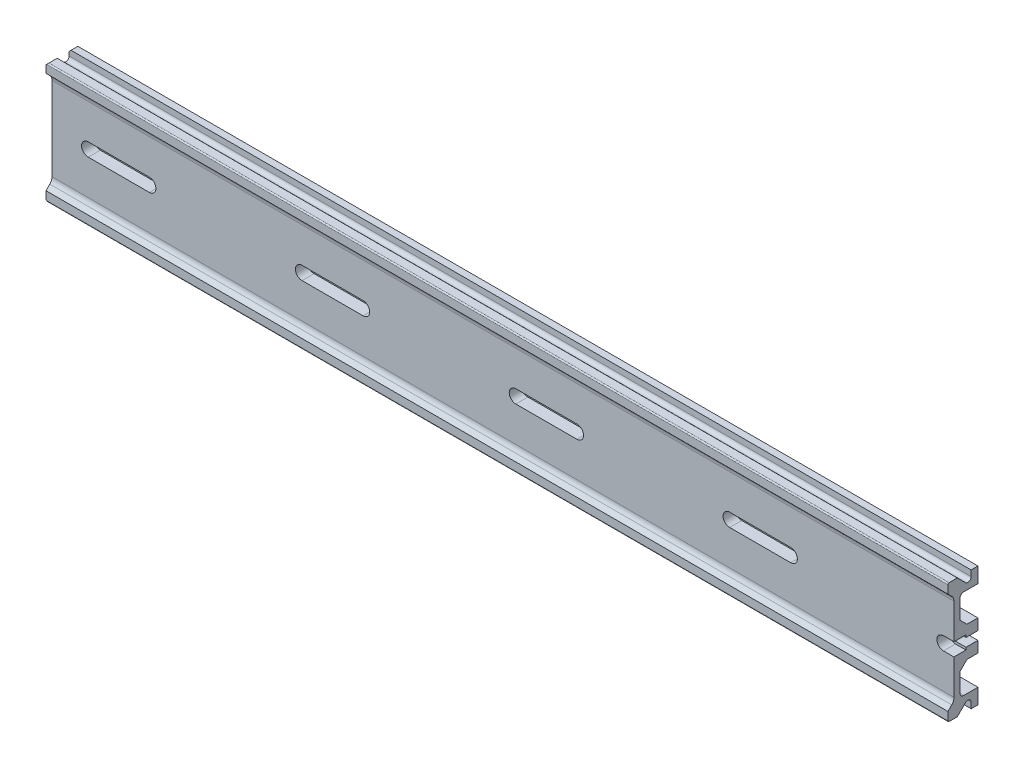
from build123d import *

# Parameters (mm, degrees)
SKETCH1_W           = 1000
SKETCH1_H           = 100
BOSS_EXTRUDE1_DEPTH = 25
CUT_EXTRUDE1_DEPTH  = 1002.561281201
CUT_EXTRUDE2_DEPTH  = 1002.561281201
CUT_EXTRUDE3_DEPTH  = 1002.561281201
CUT_EXTRUDE4_DEPTH  = 1002.561281201
CUT_EXTRUDE5_DEPTH  = 10
CUT_EXTRUDE6_DEPTH  = 504.110335811
CUT_EXTRUDE7_DEPTH  = 10
CUT_EXTRUDE8_DEPTH  = 504.110335811
CUT_EXTRUDE9_DEPTH  = 10
CUT_EXTRUDE10_DEPTH = 504.110335811
CUT_EXTRUDE11_DEPTH = 10
CUT_EXTRUDE12_DEPTH = 504.110335811
CUT_EXTRUDE13_DEPTH = 10
CUT_EXTRUDE14_DEPTH = 504.110335811
CUT_EXTRUDE15_DEPTH = 10
CUT_EXTRUDE16_DEPTH = 504.110335811
CHAMFER1_SIZE       = 5.8
CHAMFER2_SIZE       = 1.5
FILLET1_R           = 1
FILLET2_R           = 3.2
FILLET3_R           = 6.3
CUT_EXTRUDE17_START = -250
CUT_EXTRUDE17_DEPTH = 250


with BuildPart() as part:
    # Sketch1 → Boss-Extrude1 (new body)
    with BuildSketch(Plane(origin=(0, 0, 0), x_dir=(-1, 0, 0), z_dir=(0, 0, -1))):
        Rectangle(SKETCH1_W, SKETCH1_H)
    extrude(amount=-BOSS_EXTRUDE1_DEPTH)

    # Sketch2 → Cut-Extrude1 (cut, through all)
    with BuildSketch(Plane(origin=(500, 0, 0), x_dir=(0, 0, -1), z_dir=(1, 0, 0))):
        Polygon((0, 37.3), (-15, 37.3), (-15, 12.7), (-0.1, 12.7), (-0.1, -12.7), (-15, -12.7), (-15, -37.3), (0, -37.3), align=None)
    extrude(amount=-CUT_EXTRUDE1_DEPTH, mode=Mode.SUBTRACT)

    # Sketch3 → Cut-Extrude2 (cut, through all)
    with BuildSketch(Plane(origin=(500, 0, 0), x_dir=(0, 0, -1), z_dir=(1, 0, 0))):
        with BuildLine():
            Line((-17.2, -50), (-5.7, -50))
            Line((-5.7, -50), (-5.7, -45.157716447))
            ThreePointArc((-5.7, -45.157716447), (-7.402384051, -42.609918665), (-10.407716447, -43.207716447))
            Line((-10.407716447, -43.207716447), (-17.2, -50))
        make_face()
    extrude(amount=-CUT_EXTRUDE2_DEPTH, mode=Mode.SUBTRACT)

    # Sketch4 → Cut-Extrude3 (cut, through all)
    with BuildSketch(Plane(origin=(500, 0, 0), x_dir=(0, 0, -1), z_dir=(1, 0, 0))):
        Polygon((-25, -42.243650814), (-20, -37.243650814), (-20, 37.243650814), (-25, 42.243650814), align=None)
    extrude(amount=-CUT_EXTRUDE3_DEPTH, mode=Mode.SUBTRACT)

    # Sketch5 → Cut-Extrude4 (cut, through all)
    with BuildSketch(Plane(origin=(500, 0, 0), x_dir=(0, 0, -1), z_dir=(1, 0, 0))):
        with BuildLine():
            Line((-5.7, 50), (-17.2, 50))
            Line((-17.2, 50), (-10.407716447, 43.207716447))
            ThreePointArc((-10.407716447, 43.207716447), (-7.402384051, 42.609918665), (-5.7, 45.157716447))
            Line((-5.7, 45.157716447), (-5.7, 50))
        make_face()
    extrude(amount=-CUT_EXTRUDE4_DEPTH, mode=Mode.SUBTRACT)

    # Sketch6 → Cut-Extrude5 (cut)
    with BuildSketch(Plane.XY.offset(20)):
        with BuildLine():
            Line((419.1, -5.5), (469.9, -5.5))
            ThreePointArc((469.9, -5.5), (475.4, 0), (469.9, 5.5))
            Line((469.9, 5.5), (419.1, 5.5))
            ThreePointArc((419.1, 5.5), (413.6, 0), (419.1, -5.5))
        make_face()
    extrude(amount=-CUT_EXTRUDE5_DEPTH, mode=Mode.SUBTRACT)

    # Sketch7 → Cut-Extrude6 (cut, through all)
    with BuildSketch(Plane(origin=(0, 0, 0.1), x_dir=(-1, 0, 0), z_dir=(0, 0, -1))):
        with BuildLine():
            Line((-469.9, -3.5), (-419.1, -3.5))
            ThreePointArc((-419.1, -3.5), (-415.6, 0), (-419.1, 3.5))
            Line((-419.1, 3.5), (-469.9, 3.5))
            ThreePointArc((-469.9, 3.5), (-473.4, 0), (-469.9, -3.5))
        make_face()
    extrude(amount=-CUT_EXTRUDE6_DEPTH, mode=Mode.SUBTRACT)

    # Sketch8 → Cut-Extrude7 (cut)
    with BuildSketch(Plane.XY.offset(20)):
        with BuildLine():
            Line((241.3, -5.5), (292.1, -5.5))
            ThreePointArc((292.1, -5.5), (297.6, 0), (292.1, 5.5))
            Line((292.1, 5.5), (241.3, 5.5))
            ThreePointArc((241.3, 5.5), (235.8, 0), (241.3, -5.5))
        make_face()
    extrude(amount=-CUT_EXTRUDE7_DEPTH, mode=Mode.SUBTRACT)

    # Sketch9 → Cut-Extrude8 (cut, through all)
    with BuildSketch(Plane(origin=(0, 0, 0.1), x_dir=(-1, 0, 0), z_dir=(0, 0, -1))):
        with BuildLine():
            Line((-292.1, -3.5), (-241.3, -3.5))
            ThreePointArc((-241.3, -3.5), (-237.8, 0), (-241.3, 3.5))
            Line((-241.3, 3.5), (-292.1, 3.5))
            ThreePointArc((-292.1, 3.5), (-295.6, 0), (-292.1, -3.5))
        make_face()
    extrude(amount=-CUT_EXTRUDE8_DEPTH, mode=Mode.SUBTRACT)

    # Sketch10 → Cut-Extrude9 (cut)
    with BuildSketch(Plane.XY.offset(20)):
        with BuildLine():
            Line((63.5, -5.5), (114.3, -5.5))
            ThreePointArc((114.3, -5.5), (119.8, 0), (114.3, 5.5))
            Line((114.3, 5.5), (63.5, 5.5))
            ThreePointArc((63.5, 5.5), (58, 0), (63.5, -5.5))
        make_face()
    extrude(amount=-CUT_EXTRUDE9_DEPTH, mode=Mode.SUBTRACT)

    # Sketch11 → Cut-Extrude10 (cut, through all)
    with BuildSketch(Plane(origin=(0, 0, 0.1), x_dir=(-1, 0, 0), z_dir=(0, 0, -1))):
        with BuildLine():
            Line((-114.3, -3.5), (-63.5, -3.5))
            ThreePointArc((-63.5, -3.5), (-60, 0), (-63.5, 3.5))
            Line((-63.5, 3.5), (-114.3, 3.5))
            ThreePointArc((-114.3, 3.5), (-117.8, 0), (-114.3, -3.5))
        make_face()
    extrude(amount=-CUT_EXTRUDE10_DEPTH, mode=Mode.SUBTRACT)

    # Sketch12 → Cut-Extrude11 (cut)
    with BuildSketch(Plane.XY.offset(20)):
        with BuildLine():
            Line((-114.3, -5.5), (-63.5, -5.5))
            ThreePointArc((-63.5, -5.5), (-58, 0), (-63.5, 5.5))
            Line((-63.5, 5.5), (-114.3, 5.5))
            ThreePointArc((-114.3, 5.5), (-119.8, 0), (-114.3, -5.5))
        make_face()
    extrude(amount=-CUT_EXTRUDE11_DEPTH, mode=Mode.SUBTRACT)

    # Sketch13 → Cut-Extrude12 (cut, through all)
    with BuildSketch(Plane(origin=(0, 0, 0.1), x_dir=(-1, 0, 0), z_dir=(0, 0, -1))):
        with BuildLine():
            Line((63.5, -3.5), (114.3, -3.5))
            ThreePointArc((114.3, -3.5), (117.8, 0), (114.3, 3.5))
            Line((114.3, 3.5), (63.5, 3.5))
            ThreePointArc((63.5, 3.5), (60, 0), (63.5, -3.5))
        make_face()
    extrude(amount=-CUT_EXTRUDE12_DEPTH, mode=Mode.SUBTRACT)

    # Sketch14 → Cut-Extrude13 (cut)
    with BuildSketch(Plane.XY.offset(20)):
        with BuildLine():
            Line((-292.1, -5.5), (-241.3, -5.5))
            ThreePointArc((-241.3, -5.5), (-235.8, 0), (-241.3, 5.5))
            Line((-241.3, 5.5), (-292.1, 5.5))
            ThreePointArc((-292.1, 5.5), (-297.6, 0), (-292.1, -5.5))
        make_face()
    extrude(amount=-CUT_EXTRUDE13_DEPTH, mode=Mode.SUBTRACT)

    # Sketch15 → Cut-Extrude14 (cut, through all)
    with BuildSketch(Plane(origin=(0, 0, 0.1), x_dir=(-1, 0, 0), z_dir=(0, 0, -1))):
        with BuildLine():
            Line((241.3, -3.5), (292.1, -3.5))
            ThreePointArc((292.1, -3.5), (295.6, 0), (292.1, 3.5))
            Line((292.1, 3.5), (241.3, 3.5))
            ThreePointArc((241.3, 3.5), (237.8, 0), (241.3, -3.5))
        make_face()
    extrude(amount=-CUT_EXTRUDE14_DEPTH, mode=Mode.SUBTRACT)

    # Sketch16 → Cut-Extrude15 (cut)
    with BuildSketch(Plane.XY.offset(20)):
        with BuildLine():
            Line((-469.9, -5.5), (-419.1, -5.5))
            ThreePointArc((-419.1, -5.5), (-413.6, 0), (-419.1, 5.5))
            Line((-419.1, 5.5), (-469.9, 5.5))
            ThreePointArc((-469.9, 5.5), (-475.4, 0), (-469.9, -5.5))
        make_face()
    extrude(amount=-CUT_EXTRUDE15_DEPTH, mode=Mode.SUBTRACT)

    # Sketch17 → Cut-Extrude16 (cut, through all)
    with BuildSketch(Plane(origin=(0, 0, 0.1), x_dir=(-1, 0, 0), z_dir=(0, 0, -1))):
        with BuildLine():
            Line((419.1, -3.5), (469.9, -3.5))
            ThreePointArc((469.9, -3.5), (473.4, 0), (469.9, 3.5))
            Line((469.9, 3.5), (419.1, 3.5))
            ThreePointArc((419.1, 3.5), (415.6, 0), (419.1, -3.5))
        make_face()
    extrude(amount=-CUT_EXTRUDE16_DEPTH, mode=Mode.SUBTRACT)

    # Chamfer1
    chamfer1_edges = [part.edges().sort_by_distance(p)[0] for p in [
        (0, -12.7, 15),
        (0, 12.7, 15),
    ]]
    chamfer(chamfer1_edges, length=CHAMFER1_SIZE)

    # Chamfer2
    chamfer2_edges = [part.edges().sort_by_distance(p)[0] for p in [
        (500, -50, 2.85),
        (-500, -50, 2.85),
        (-500, 50, 21.1),
        (-500, -50, 21.1),
        (500, -50, 21.1),
        (500, 50, 2.85),
        (500, 50, 21.1),
        (-500, 50, 2.85),
    ]]
    chamfer(chamfer2_edges, length=CHAMFER2_SIZE)

    # Fillet1
    fillet1_edges = [part.edges().sort_by_distance(p)[0] for p in [
        (0, 50, 25),
        (0, -50, 25),
    ]]
    fillet(fillet1_edges, radius=FILLET1_R)

    # Fillet2
    fillet2_edges = [part.edges().sort_by_distance(p)[0] for p in [
        (0, -37.3, 15),
        (0, 37.3, 15),
    ]]
    fillet(fillet2_edges, radius=FILLET2_R)

    # Fillet3
    fillet3_edges = [part.edges().sort_by_distance(p)[0] for p in [
        (0, 37.243650814, 20),
        (0, -37.243650814, 20),
    ]]
    fillet(fillet3_edges, radius=FILLET3_R)

    # Sketch18 → Cut-Extrude17 (cut)
    with BuildSketch(Plane(origin=(500, 0, 0), x_dir=(0, 0, -1), z_dir=(1, 0, 0)).offset(CUT_EXTRUDE17_START)):
        with BuildLine():
            Line((-5.7, 50), (-5.7, 48.5))
            Line((-5.7, 48.5), (-5.7, 45.157716447))
            ThreePointArc((-5.7, 45.157716447), (-7.402384051, 42.609918665), (-10.407716447, 43.207716447))
            Line((-10.407716447, 43.207716447), (-15.7, 48.5))
            Line((-15.7, 48.5), (-17.2, 50))
            Line((-17.2, 50), (-24, 50))
            ThreePointArc((-24, 50), (-24.707106781, 49.707106781), (-25, 49))
            Line((-25, 49), (-25, 48.5))
            Line((-25, 48.5), (-25, 42.243650814))
            Line((-25, 42.243650814), (-21.845227279, 39.088878092))
            ThreePointArc((-21.845227279, 39.088878092), (-20.479558945, 37.045010995), (-20, 34.634105371))
            Line((-20, 34.634105371), (-20, -34.634105371))
            ThreePointArc((-20, -34.634105371), (-20.479558945, -37.045010995), (-21.845227279, -39.088878092))
            Line((-21.845227279, -39.088878092), (-25, -42.243650814))
            Line((-25, -42.243650814), (-25, -48.5))
            Line((-25, -48.5), (-25, -49))
            ThreePointArc((-25, -49), (-24.707106781, -49.707106781), (-24, -50))
            Line((-24, -50), (-17.2, -50))
            Line((-17.2, -50), (-15.7, -48.5))
            Line((-15.7, -48.5), (-10.407716447, -43.207716447))
            ThreePointArc((-10.407716447, -43.207716447), (-7.402384051, -42.609918665), (-5.7, -45.157716447))
            Line((-5.7, -45.157716447), (-5.7, -48.5))
            Line((-5.7, -48.5), (-5.7, -50))
            Line((-5.7, -50), (0, -50))
            Line((0, -50), (0, -48.5))
            Line((0, -48.5), (0, -37.3))
            Line((0, -37.3), (-11.8, -37.3))
            ThreePointArc((-11.8, -37.3), (-14.0627417, -36.3627417), (-15, -34.1))
            Line((-15, -34.1), (-15, -18.5))
            Line((-15, -18.5), (-9.2, -12.7))
            Line((-9.2, -12.7), (-0.1, -12.7))
            Line((-0.1, -12.7), (-0.1, 12.7))
            Line((-0.1, 12.7), (-9.2, 12.7))
            Line((-9.2, 12.7), (-15, 18.5))
            Line((-15, 18.5), (-15, 34.1))
            ThreePointArc((-15, 34.1), (-14.0627417, 36.3627417), (-11.8, 37.3))
            Line((-11.8, 37.3), (0, 37.3))
            Line((0, 37.3), (0, 48.5))
            Line((0, 48.5), (0, 50))
            Line((0, 50), (-5.7, 50))
        make_face()
    extrude(amount=CUT_EXTRUDE17_DEPTH, mode=Mode.SUBTRACT)


solid = part.part
